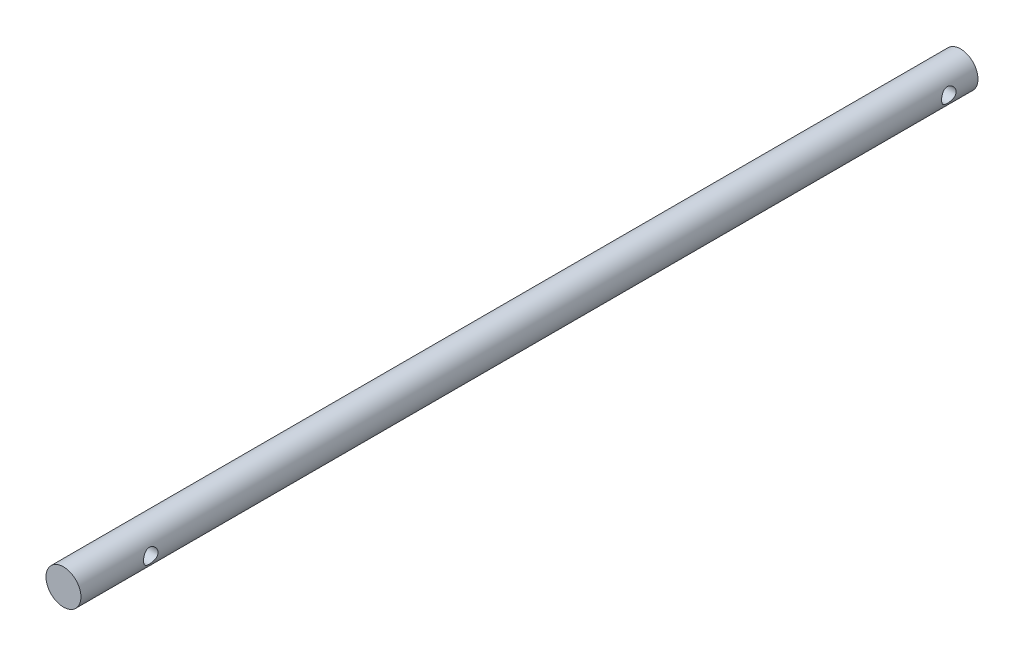
from build123d import *

# Parameters (mm, degrees)
ESQUISSE1_R                  = 3
BOSS_EXTRU_1_DEPTH           = 154
ENL_V_MAT_EXTRU_1_DEPTH      = 155.058430474
ENL_V_MAT_EXTRU_1_DEPTH_BACK = 155.058430474
ESQUISSE2_R                  = 1.25


with BuildPart() as part:
    # Esquisse1 → Boss.-Extru.1 (new body)
    with BuildSketch(Plane.XY):
        Circle(ESQUISSE1_R)
    extrude(amount=BOSS_EXTRU_1_DEPTH)

    # Esquisse2 → Enlèv. mat.-Extru.1 (cut, two sides: drawn at the far end of the back side and taken through both)
    with BuildSketch(Plane(origin=(0, 0, 0), x_dir=(0, 0, -1), z_dir=(1, 0, 0)).offset(-ENL_V_MAT_EXTRU_1_DEPTH_BACK)):
        with Locations(Location((-5, 0, 0), (0, 0, 180.000000002))):
            Circle(ESQUISSE2_R)
        with Locations(Location((-142, 0, 0), (0, 0, 180.000000002))):
            Circle(ESQUISSE2_R)
    extrude(amount=ENL_V_MAT_EXTRU_1_DEPTH + ENL_V_MAT_EXTRU_1_DEPTH_BACK, mode=Mode.SUBTRACT)


solid = part.part
